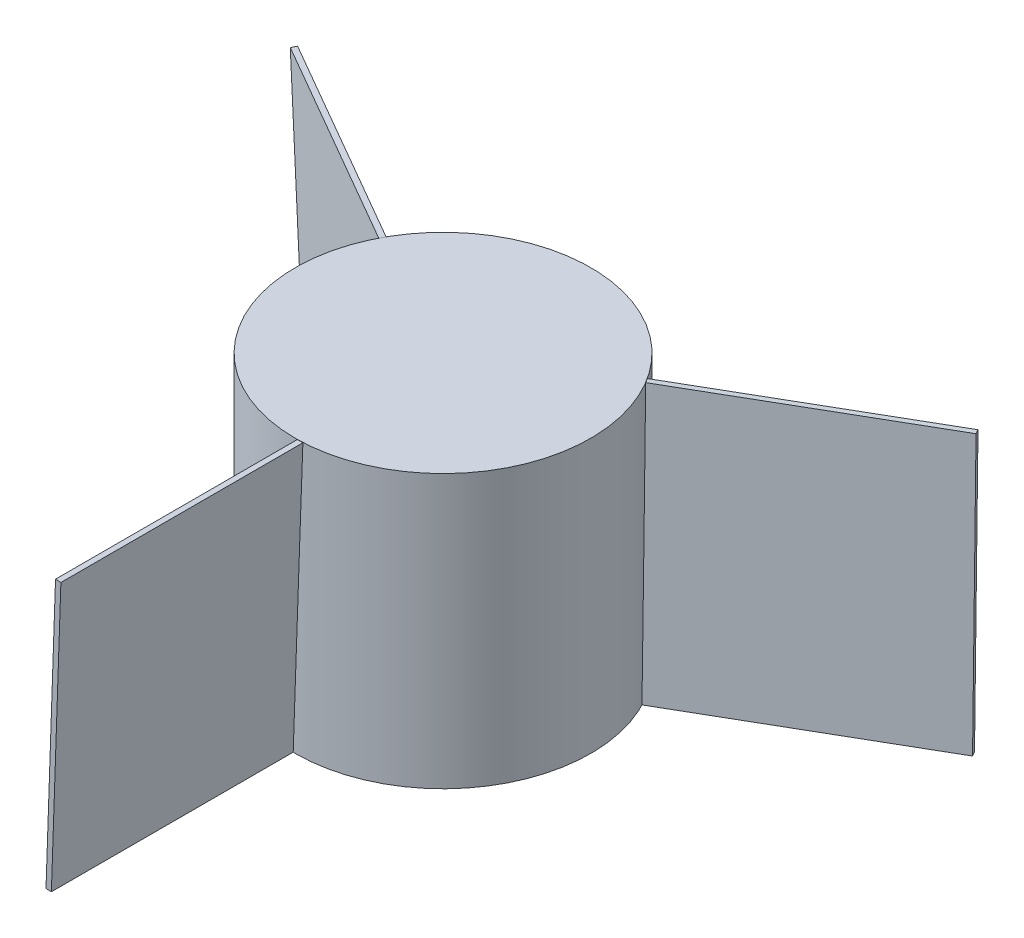
from build123d import *

# Parameters (mm, degrees)
SKETCH1_R           = 82.5
BOSS_EXTRUDE1_DEPTH = 152.4
SKETCH3_W           = 217.5
SKETCH3_H           = 152.307162038
BOSS_EXTRUDE2_DEPTH = 1.5
CIRPATTERN1_COUNT   = 3


with BuildPart() as part:
    # Sketch1 → Boss-Extrude1 (new body)
    with BuildSketch(Plane(origin=(0, 0, 0), x_dir=(1, 0, 0), z_dir=(0, 1, 0))):
        Circle(SKETCH1_R)
    extrude(amount=BOSS_EXTRUDE1_DEPTH)

    # Sketch3 → Boss-Extrude2 (add, symmetric)
    with BuildSketch(Plane(origin=(-2.65772165, 0.092809685, 0), x_dir=(0, 0, -1), z_dir=(0.9993908270190958, -0.03489949670250104, 0))):
        with Locations((-108.75, 76.153581019)):
            Rectangle(SKETCH3_W, SKETCH3_H)
    boss_extrude2 = extrude(amount=BOSS_EXTRUDE2_DEPTH, both=True)

    # CirPattern1: Boss-Extrude2 ×3 about axis
    cirpattern1_axis = Axis((0, 152.4, 0), (0, -1, 0))
    for i in range(1, CIRPATTERN1_COUNT):
        add(boss_extrude2.rotate(cirpattern1_axis, i * 360 / CIRPATTERN1_COUNT))


solid = part.part
